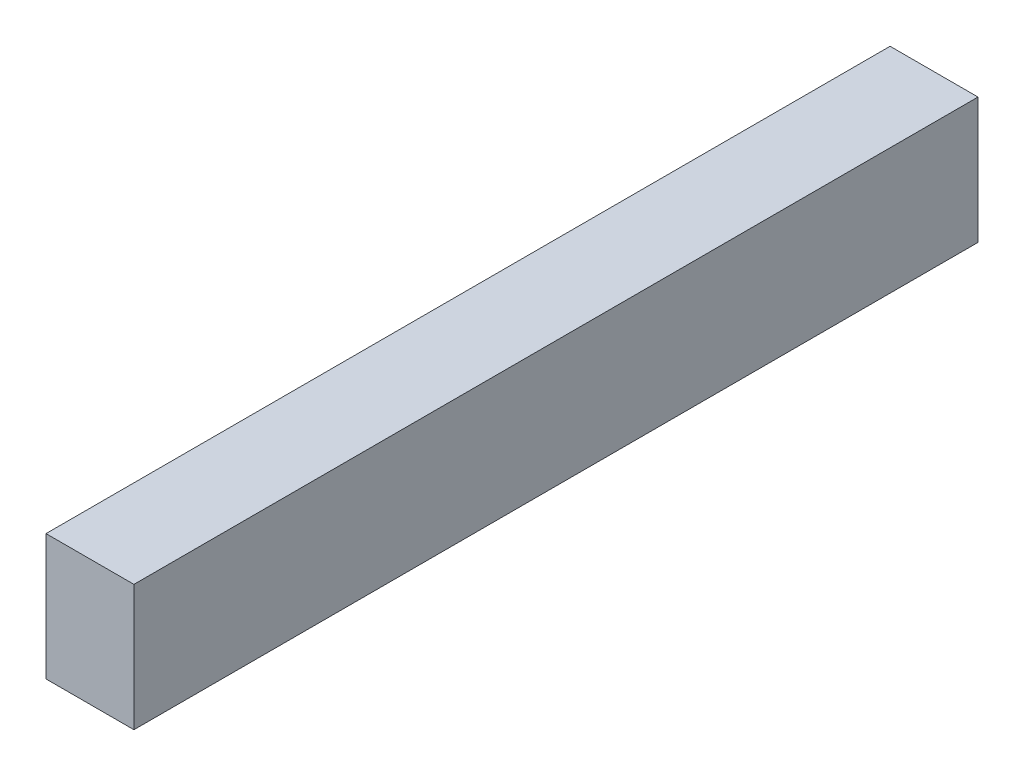
from build123d import *

# Parameters (mm, degrees)
SKETCH1_W           = 3.175
SKETCH1_H           = 4.5466
BOSS_EXTRUDE1_DEPTH = 15.24


with BuildPart() as part:
    # Sketch1 → Boss-Extrude1 (new, symmetric)
    with BuildSketch(Plane.XY):
        Rectangle(SKETCH1_W, SKETCH1_H)
    extrude(amount=BOSS_EXTRUDE1_DEPTH, both=True)


solid = part.part
